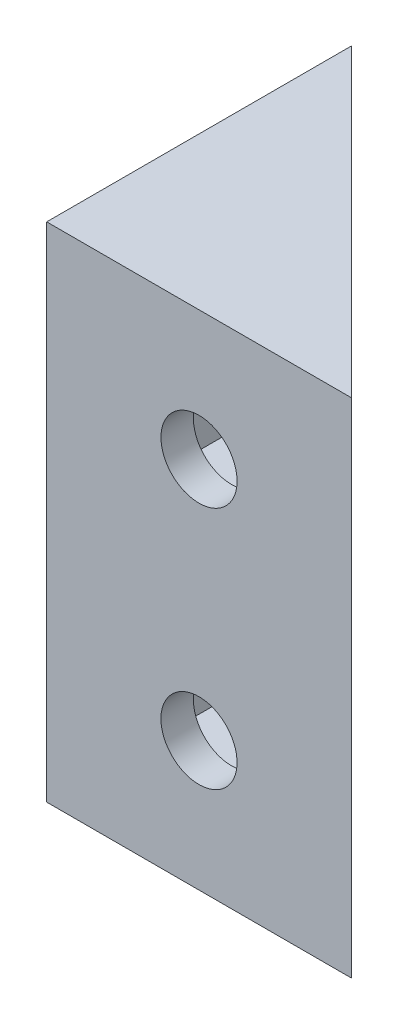
from build123d import *
from OCP.BRepFilletAPI import BRepFilletAPI_MakeChamfer

# Parameters (mm, degrees)
EXTRUDE_1_DEPTH      = 16.5
EXTRUDE_1_DEPTH_BACK = 16.5
EXTRUDE_2_DEPTH      = 3
EXTRUDE_3_DEPTH      = 3
EXTRUDE_4_DEPTH      = 1.5
EXTRUDE_4_DEPTH_BACK = 1.5
SKETCH_5_R           = 2.5
CUT_EXTRUDE_1_DEPTH  = 33.74522866
SKETCH_6_R           = 2.5
CUT_EXTRUDE_2_DEPTH  = 33.74522866
CHAMFER_1_SIZE       = 1.5
CHAMFER_1_SIZE2      = 0.866025404


with BuildPart() as part:
    # Эскиз1 → Бобышка-Вытянуть1 (new, two sides: drawn at the far end of the back side and taken through both)
    with BuildSketch(Plane(origin=(0, 0, 0), x_dir=(1, 0, 0), z_dir=(0, 1, 0)).offset(-EXTRUDE_1_DEPTH_BACK)):
        Polygon((0, 0), (0, 20), (3, 17), (3, 3), (17, 3), (20, 0), align=None)
    extrude(amount=EXTRUDE_1_DEPTH + EXTRUDE_1_DEPTH_BACK)

    # Эскиз2 → Бобышка-Вытянуть2 (add)
    with BuildSketch(Plane(origin=(0, 16.5, 0), x_dir=(1, 0, 0), z_dir=(0, 1, 0))):
        Polygon((0, 20), (0, 0), (20, 0), align=None)
    extrude(amount=-EXTRUDE_2_DEPTH)

    # Эскиз3 → Бобышка-Вытянуть3 (add)
    with BuildSketch(Plane(origin=(0, -16.5, 0), x_dir=(-1, 0, 0), z_dir=(0, -1, 0))):
        Polygon((0, 0), (-20, 0), (0, 20), align=None)
    extrude(amount=-EXTRUDE_3_DEPTH)

    # Эскиз4 → Бобышка-Вытянуть4 (add, two sides: drawn at the far end of the back side and taken through both)
    with BuildSketch(Plane(origin=(0, 0, 0), x_dir=(1, 0, 0), z_dir=(0, 1, 0)).offset(-EXTRUDE_4_DEPTH_BACK)):
        Polygon((20, 0), (0, 0), (0, 20), align=None)
    extrude(amount=EXTRUDE_4_DEPTH + EXTRUDE_4_DEPTH_BACK)

    # Эскиз5 → Вырез-Вытянуть1 (cut, through all)
    with BuildSketch(Plane.XY):
        with Locations((10, 8)):
            Circle(SKETCH_5_R)
        with Locations((10, -8)):
            Circle(SKETCH_5_R)
    extrude(amount=-CUT_EXTRUDE_1_DEPTH, mode=Mode.SUBTRACT)

    # Эскиз6 → Вырез-Вытянуть2 (cut, through all)
    with BuildSketch(Plane.ZY):
        with Locations((-10, 8)):
            Circle(SKETCH_6_R)
        with Locations((-10, -8)):
            Circle(SKETCH_6_R)
    extrude(amount=-CUT_EXTRUDE_2_DEPTH, mode=Mode.SUBTRACT)

    # Фаска1: one chamfer whose edges measure the first distance from different faces: ONE call of the kernel's chamfer builder (chamfer() names one face for all edges)
    chamfer_1_edges_1 = [part.edges().sort_by_distance(p)[0] for p in [
        (7.5, 8, -3),
    ]]
    chamfer_1_side_1 = [part.faces().sort_by_distance(p)[0] for p in [
        (3.184390889, 7.5, -3),
    ]]
    chamfer_1_edges_2 = [part.edges().sort_by_distance(p)[0] for p in [
        (7.5, -8, -3),
    ]]
    chamfer_1_side_2 = [part.faces().sort_by_distance(p)[0] for p in [
        (3.184390889, -7.5, -3),
    ]]
    chamfer_1_edges_3 = [part.edges().sort_by_distance(p)[0] for p in [
        (3, -8, -12.5),
    ]]
    chamfer_1_side_3 = [part.faces().sort_by_distance(p)[0] for p in [
        (3, -7.5, -16.815609111),
    ]]
    chamfer_1_edges_4 = [part.edges().sort_by_distance(p)[0] for p in [
        (3, 8, -12.5),
    ]]
    chamfer_1_side_4 = [part.faces().sort_by_distance(p)[0] for p in [
        (3, 7.5, -16.815609111),
    ]]
    chamfer_1 = BRepFilletAPI_MakeChamfer(part.part.solid().wrapped)
    for e in chamfer_1_edges_1:
        chamfer_1.Add(CHAMFER_1_SIZE, CHAMFER_1_SIZE2, e.wrapped, chamfer_1_side_1[0].wrapped)  # the first distance lies on this face
    for e in chamfer_1_edges_2:
        chamfer_1.Add(CHAMFER_1_SIZE, CHAMFER_1_SIZE2, e.wrapped, chamfer_1_side_2[0].wrapped)  # the first distance lies on this face
    for e in chamfer_1_edges_3:
        chamfer_1.Add(CHAMFER_1_SIZE, CHAMFER_1_SIZE2, e.wrapped, chamfer_1_side_3[0].wrapped)  # the first distance lies on this face
    for e in chamfer_1_edges_4:
        chamfer_1.Add(CHAMFER_1_SIZE, CHAMFER_1_SIZE2, e.wrapped, chamfer_1_side_4[0].wrapped)  # the first distance lies on this face
    add(Compound.cast(chamfer_1.Shape()), mode=Mode.REPLACE)


solid = part.part
